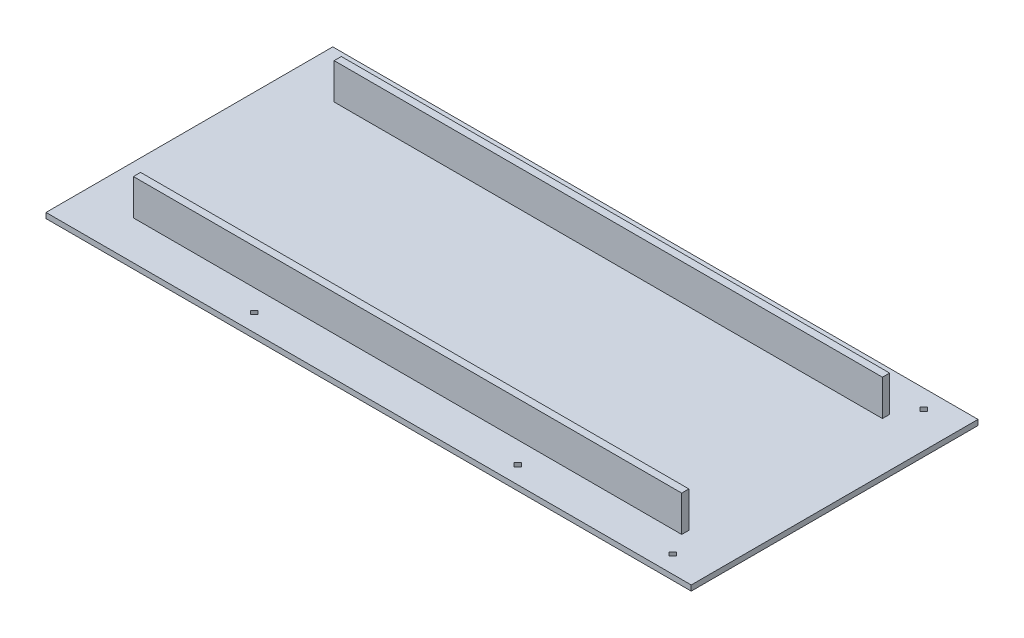
from build123d import *

# Parameters (mm, degrees)
SKETCH_1_W      = 180
SKETCH_1_H      = 80
EXTRUDE_1_DEPTH = 1.5
SKETCH_2_W      = 152.95364467
SKETCH_2_H      = 2
EXTRUDE_2_DEPTH = 10


with BuildPart() as part:
    # 草图1 → 凸台-拉伸1 (new body)
    with BuildSketch(Plane(origin=(0, 0, 0), x_dir=(1, 0, 0), z_dir=(0, 1, 0))):
        with Locations((0, 0.134932534)):
            Rectangle(SKETCH_1_W, SKETCH_1_H)
        Polygon((37.76, 35), (36.76, 34), (35.76, 35), (36.76, 36), align=None, mode=Mode.SUBTRACT)
        Polygon((-36.76, 34), (-35.76, 35), (-36.76, 36), (-37.76, 35), align=None, mode=Mode.SUBTRACT)
        Polygon((36.76, -36), (37.76, -35), (36.76, -34), (35.76, -35), align=None, mode=Mode.SUBTRACT)
        Polygon((-37.76, -35), (-36.76, -34), (-35.76, -35), (-36.76, -36), align=None, mode=Mode.SUBTRACT)
        Polygon((81, -35), (80, -36), (79, -35), (80, -34), align=None, mode=Mode.SUBTRACT)
        Polygon((80, 36), (79, 35), (80, 34), (81, 35), align=None, mode=Mode.SUBTRACT)
    extrude(amount=EXTRUDE_1_DEPTH)

    # 草图2 → 凸台-拉伸2 (add)
    with BuildSketch(Plane(origin=(0, 1.5, 0), x_dir=(1, 0, 0), z_dir=(0, 1, 0))):
        with Locations((0, 28)):
            Rectangle(SKETCH_2_W, SKETCH_2_H)
        with Locations((0, -28)):
            Rectangle(SKETCH_2_W, SKETCH_2_H)
    extrude(amount=EXTRUDE_2_DEPTH)


solid = part.part
